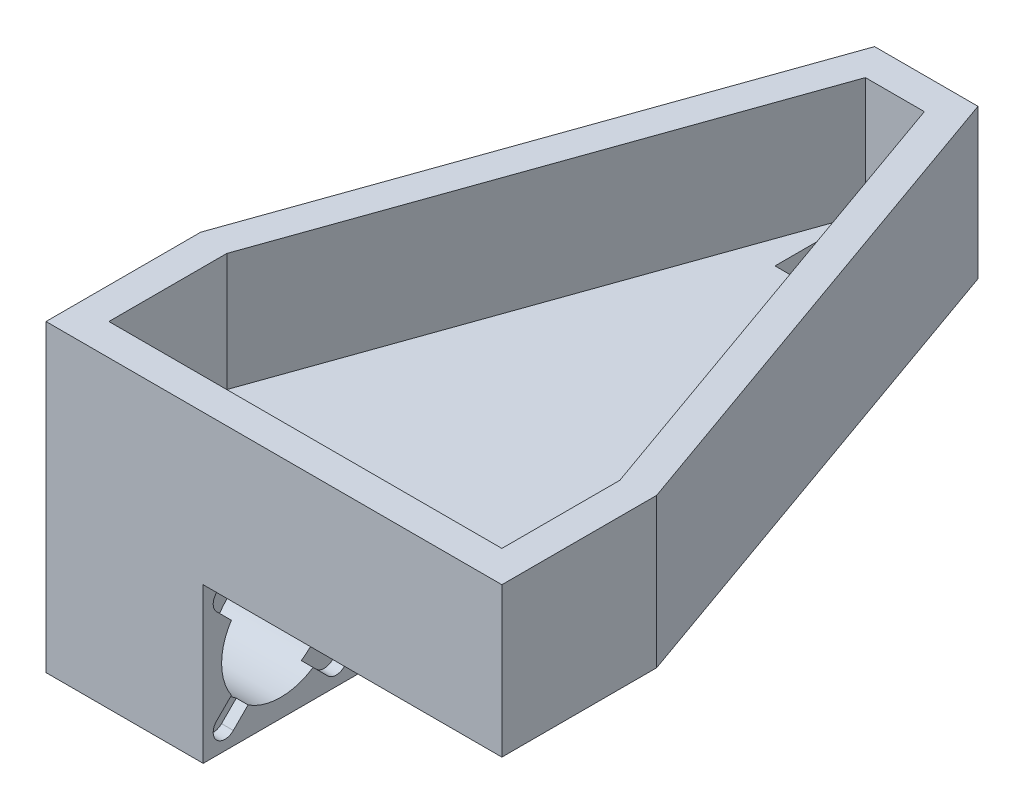
from build123d import *

# Parameters (mm, degrees)
BOSS_EXTRUDE1_DEPTH = 30
SHELL2_T            = 8
SKETCH2_W           = 15
SKETCH2_H           = 23
CUT_EXTRUDE1_DEPTH  = 8
SKETCH3_W           = 15
SKETCH3_H           = 3
CUT_EXTRUDE2_DEPTH  = 5
SKETCH4_W           = 39.3748274
SKETCH4_H           = 39.3748274
SKETCH4_R           = 15
BOSS_EXTRUDE2_DEPTH = 40
CUT_EXTRUDE3_START  = -3
CUT_EXTRUDE3_DEPTH  = 3
CIRPATTERN1_COUNT   = 4


with BuildPart() as part:
    # Sketch1 → Boss-Extrude1 (new body)
    with BuildSketch(Plane(origin=(0, 0, 0), x_dir=(1, 0, 0), z_dir=(0, 1, 0))):
        Polygon((-50, 0), (50, 0), (50, 30), (7.5, 150), (-7.5, 150), (-50, 30), align=None)
    extrude(amount=BOSS_EXTRUDE1_DEPTH)

    # Shell2
    shell2_openings = [part.faces().sort_by_distance(p)[0] for p in [
        (0, 30, -56.96969697),
    ]]
    offset(amount=SHELL2_T, openings=shell2_openings, kind=Kind.INTERSECTION)

    # Sketch2 → Cut-Extrude1 (cut)
    with BuildSketch(Plane(origin=(0, -8, 0), x_dir=(-1, 0, 0), z_dir=(0, -1, 0))):
        with Locations((0, 138.5)):
            Rectangle(SKETCH2_W, SKETCH2_H)
    extrude(amount=-CUT_EXTRUDE1_DEPTH, mode=Mode.SUBTRACT)

    # Sketch3 → Cut-Extrude2 (cut)
    with BuildSketch(Plane.XY.offset(-150)):
        with Locations((0, 1.5)):
            Rectangle(SKETCH3_W, SKETCH3_H)
    extrude(amount=-CUT_EXTRUDE2_DEPTH, mode=Mode.SUBTRACT)

    # Sketch4 → Boss-Extrude2 (add)
    with BuildSketch(Plane.ZY.offset(58)):
        with Locations((-11.6874137, -27.6874137)):
            Rectangle(SKETCH4_W, SKETCH4_H)
        with Locations((-11.6874137, -27.6874137)):
            Circle(SKETCH4_R, mode=Mode.SUBTRACT)
    extrude(amount=-BOSS_EXTRUDE2_DEPTH)

    # Sketch5 → Cut-Extrude3 (cut)
    with BuildSketch(Plane(origin=(-18, 0, 0), x_dir=(0, 0, -1), z_dir=(1, 0, 0)).offset(CUT_EXTRUDE3_START)):
        with BuildLine():
            Line((27.950869668, -15.66659842), (24.201038889, -19.416429198))
            ThreePointArc((24.201038889, -19.416429198), (22.294015418, -17.080811982), (19.958398202, -15.173788511))
            Line((19.958398202, -15.173788511), (23.70822898, -11.423957733))
            ThreePointArc((23.70822898, -11.423957733), (27.950869668, -11.423957733), (27.950869668, -15.66659842))
        make_face()
    cut_extrude3 = extrude(amount=CUT_EXTRUDE3_DEPTH, mode=Mode.SUBTRACT)

    # CirPattern1: Cut-Extrude3 ×4 about axis
    cirpattern1_axis = Axis((0, -27.6874137, -11.6874137), (1, 0, 0))
    for i in range(1, CIRPATTERN1_COUNT):
        add(cut_extrude3.rotate(cirpattern1_axis, i * 360 / CIRPATTERN1_COUNT), mode=Mode.SUBTRACT)


solid = part.part
